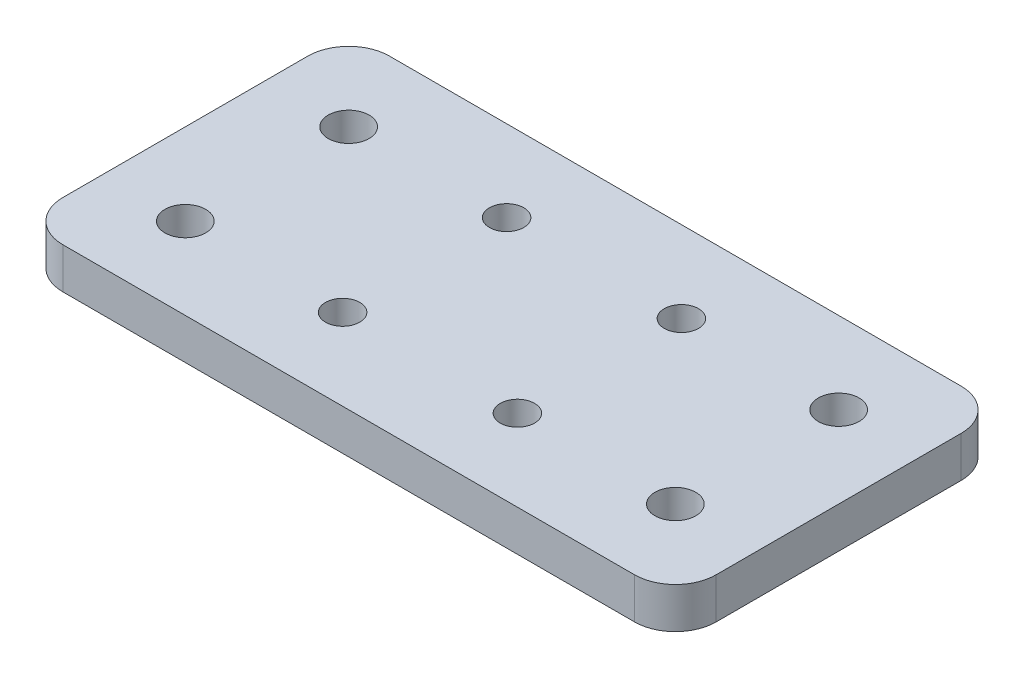
from build123d import *

# Parameters (mm, degrees)
SKETCH1_W           = 101.6
SKETCH1_H           = 50.8
BOSS_EXTRUDE1_DEPTH = 6.35
CUT_EXTRUDE2_REACH  = 59.15
SKETCH3_R           = 3.175
SKETCH3_R_2         = 2.667
FILLET1_R           = 6.35


with BuildPart() as part:
    # Sketch1 → Boss-Extrude1 (new body)
    with BuildSketch(Plane(origin=(0, 0, 0), x_dir=(1, 0, 0), z_dir=(0, 1, 0))):
        Rectangle(SKETCH1_W, SKETCH1_H)
    extrude(amount=BOSS_EXTRUDE1_DEPTH)

    # Sketch3 → Cut-Extrude2 (cut, up to next)
    with BuildSketch(Plane.XZ, mode=Mode.PRIVATE) as cut_extrude2_sk1:
        with Locations(Location((-38.1, 12.7, 0), (0, 0, 270))):
            Circle(SKETCH3_R)
    cut_extrude2_tool1 = extrude(cut_extrude2_sk1.sketch, amount=-CUT_EXTRUDE2_REACH, mode=Mode.PRIVATE) & part.part
    # Sketch3 → Cut-Extrude2 (cut, up to next)
    with BuildSketch(Plane.XZ, mode=Mode.PRIVATE) as cut_extrude2_sk2:
        with Locations(Location((-38.1, -12.7, 0), (0, 0, 90))):
            Circle(SKETCH3_R)
    cut_extrude2_tool2 = extrude(cut_extrude2_sk2.sketch, amount=-CUT_EXTRUDE2_REACH, mode=Mode.PRIVATE) & part.part
    # Sketch3 → Cut-Extrude2 (cut, up to next)
    with BuildSketch(Plane.XZ, mode=Mode.PRIVATE) as cut_extrude2_sk3:
        with Locations(Location((38.1, 12.7, 0), (0, 0, 90))):
            Circle(SKETCH3_R)
    cut_extrude2_tool3 = extrude(cut_extrude2_sk3.sketch, amount=-CUT_EXTRUDE2_REACH, mode=Mode.PRIVATE) & part.part
    # Sketch3 → Cut-Extrude2 (cut, up to next)
    with BuildSketch(Plane.XZ, mode=Mode.PRIVATE) as cut_extrude2_sk4:
        with Locations(Location((38.1, -12.7, 0), (0, 0, 270))):
            Circle(SKETCH3_R)
    cut_extrude2_tool4 = extrude(cut_extrude2_sk4.sketch, amount=-CUT_EXTRUDE2_REACH, mode=Mode.PRIVATE) & part.part
    # Sketch3 → Cut-Extrude2 (cut, up to next)
    with BuildSketch(Plane.XZ, mode=Mode.PRIVATE) as cut_extrude2_sk5:
        with Locations(Location((13.589, -12.75, 0), (0, 0, 90))):
            Circle(SKETCH3_R_2)
    cut_extrude2_tool5 = extrude(cut_extrude2_sk5.sketch, amount=-CUT_EXTRUDE2_REACH, mode=Mode.PRIVATE) & part.part
    # Sketch3 → Cut-Extrude2 (cut, up to next)
    with BuildSketch(Plane.XZ, mode=Mode.PRIVATE) as cut_extrude2_sk6:
        with Locations(Location((-13.589, -12.75, 0), (0, 0, 270))):
            Circle(SKETCH3_R_2)
    cut_extrude2_tool6 = extrude(cut_extrude2_sk6.sketch, amount=-CUT_EXTRUDE2_REACH, mode=Mode.PRIVATE) & part.part
    # Sketch3 → Cut-Extrude2 (cut, up to next)
    with BuildSketch(Plane.XZ, mode=Mode.PRIVATE) as cut_extrude2_sk7:
        with Locations(Location((13.589, 12.75, 0), (0, 0, 270))):
            Circle(SKETCH3_R_2)
    cut_extrude2_tool7 = extrude(cut_extrude2_sk7.sketch, amount=-CUT_EXTRUDE2_REACH, mode=Mode.PRIVATE) & part.part
    # Sketch3 → Cut-Extrude2 (cut, up to next)
    with BuildSketch(Plane.XZ, mode=Mode.PRIVATE) as cut_extrude2_sk8:
        with Locations(Location((-13.589, 12.75, 0), (0, 0, 90))):
            Circle(SKETCH3_R_2)
    cut_extrude2_tool8 = extrude(cut_extrude2_sk8.sketch, amount=-CUT_EXTRUDE2_REACH, mode=Mode.PRIVATE) & part.part
    add(cut_extrude2_tool1.solids().sort_by_distance((-38.1, 0, 12.7))[0], mode=Mode.SUBTRACT)
    add(cut_extrude2_tool2.solids().sort_by_distance((-38.1, 0, -12.7))[0], mode=Mode.SUBTRACT)
    add(cut_extrude2_tool3.solids().sort_by_distance((38.1, 0, 12.7))[0], mode=Mode.SUBTRACT)
    add(cut_extrude2_tool4.solids().sort_by_distance((38.1, 0, -12.7))[0], mode=Mode.SUBTRACT)
    add(cut_extrude2_tool5.solids().sort_by_distance((13.589, 0, -12.75))[0], mode=Mode.SUBTRACT)
    add(cut_extrude2_tool6.solids().sort_by_distance((-13.589, 0, -12.75))[0], mode=Mode.SUBTRACT)
    add(cut_extrude2_tool7.solids().sort_by_distance((13.589, 0, 12.75))[0], mode=Mode.SUBTRACT)
    add(cut_extrude2_tool8.solids().sort_by_distance((-13.589, 0, 12.75))[0], mode=Mode.SUBTRACT)

    # Fillet1
    fillet1_edges = [part.edges().sort_by_distance(p)[0] for p in [
        (50.8, 3.175, 25.4),
        (-50.8, 3.175, 25.4),
        (-50.8, 3.175, -25.4),
        (50.8, 3.175, -25.4),
    ]]
    fillet(fillet1_edges, radius=FILLET1_R)


solid = part.part
